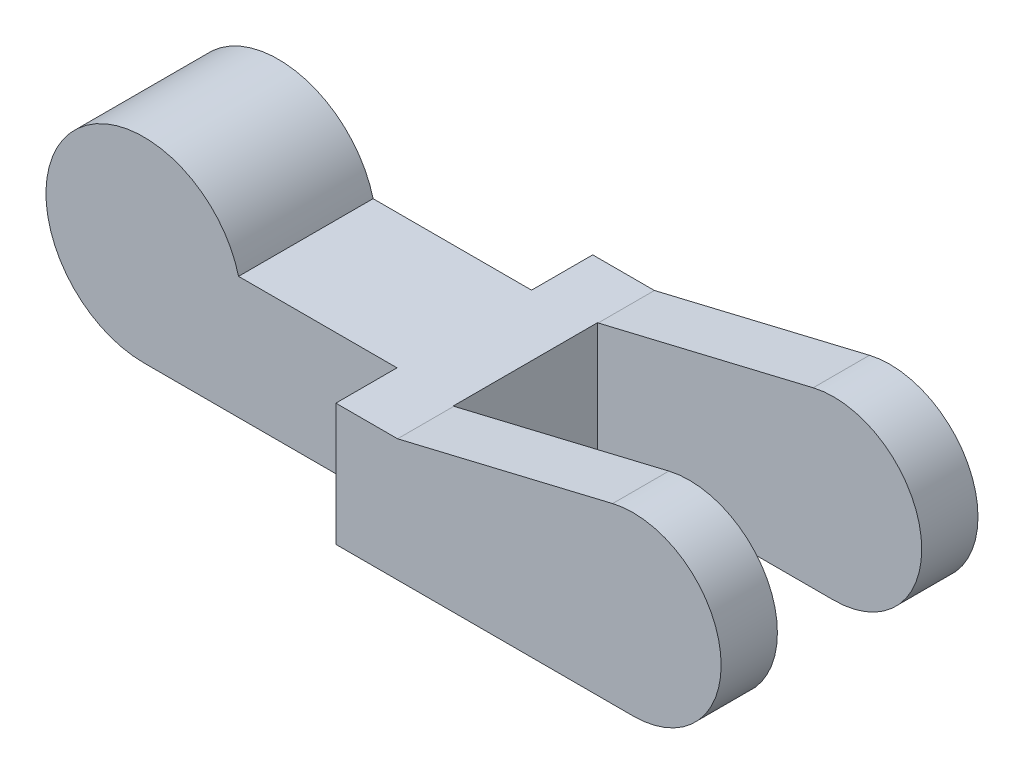
from build123d import *

# Parameters (mm, degrees)
BOSS_EXTRUDE1_DEPTH     = 105
CUT_EXTRUDE1_DEPTH      = 539.431982705
CUT_EXTRUDE1_DEPTH_BACK = 539.431982705
SKETCH2_W               = 118
SKETCH2_H               = 301.652122342
SKETCH2_W_2             = 63.240183757
SKETCH2_H_2             = 323.962100031
BODY_MOVE_COPY2_ANGLE   = 180


with BuildPart() as part:
    # Sketch1 → Boss-Extrude1 (new, symmetric)
    with BuildSketch(Plane.XY):
        with BuildLine():
            Line((-80, 0), (-80, 450))
            ThreePointArc((-80, 450), (0.428269124, 521.504994788), (62.026785544, 433.259351673))
            Line((62.026785544, 433.259351673), (20, 257.459666924))
            Line((20, 257.459666924), (20, 77.459666924))
            ThreePointArc((20, 77.459666924), (48.989794856, -63.245553203), (-80, 0))
        make_face()
    extrude(amount=BOSS_EXTRUDE1_DEPTH, both=True)

    # Sketch2 → Cut-Extrude1 (cut, two sides: drawn at the far end of the back side and taken through both)
    with BuildSketch(Plane(origin=(0, 0, 0), x_dir=(0, 0, -1), z_dir=(1, 0, 0)).offset(-CUT_EXTRUDE1_DEPTH_BACK)):
        with Locations((0, 407.826061171)):
            Rectangle(SKETCH2_W, SKETCH2_H)
        with Locations((-86.620091879, 45.018949984)):
            Rectangle(SKETCH2_W_2, SKETCH2_H_2)
        with Locations((86.620091879, 45.018949984)):
            Rectangle(SKETCH2_W_2, SKETCH2_H_2)
    extrude(amount=CUT_EXTRUDE1_DEPTH + CUT_EXTRUDE1_DEPTH_BACK, mode=Mode.SUBTRACT)


with BuildPart() as part_1:
    # Body-Move/Copy1: moved
    add(part.part.moved(Location((8, -450, 0))))


with BuildPart() as part_2:
    # Body-Move/Copy2: moved
    add(part_1.part.rotate(Axis((0, 0, 0), (0.7071067811865605, 0.7071067811865346, 0)), BODY_MOVE_COPY2_ANGLE))


solid = part_2.part
